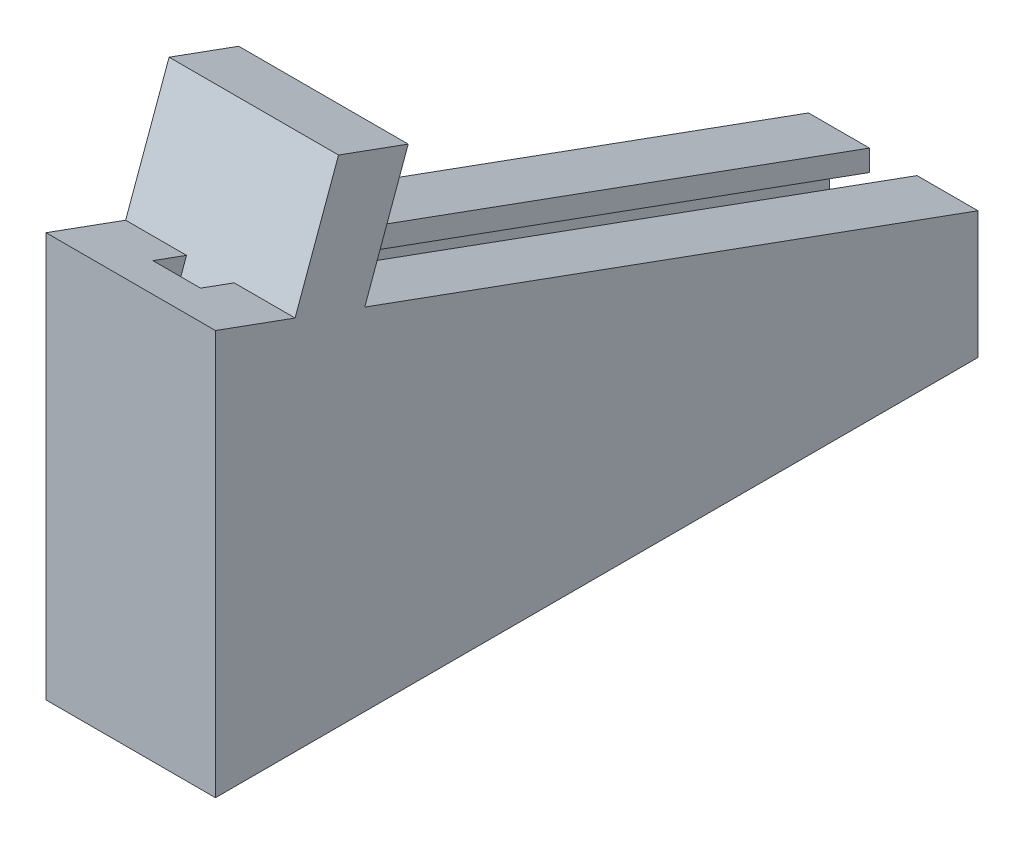
from build123d import *

# Parameters (mm, degrees)
BOSS_EXTRUDE1_DEPTH = 8
BOSS_EXTRUDE2_DEPTH = 8


with BuildPart() as part:
    # Sketch2 → Boss-Extrude1 (new body)
    with BuildSketch(Plane(origin=(0, 0, 0), x_dir=(0, 0, -1), z_dir=(1, 0, 0))):
        Polygon((-10.928495294, -9.782945939), (25.071504706, -9.782945939), (25.071504706, -3.782945939), (-10.928495294, 9.319982495), align=None)
    extrude(amount=-BOSS_EXTRUDE1_DEPTH)

    # Cut-Sweep3: sweep along a path in Sketch5
    with BuildLine(Plane.ZY.offset(8)) as cut_sweep3_path:
        Line((-25.071504706, -6.975479256), (8.757429642, 5.337245904))
    # Sketch3 → Cut-Sweep3 (sweep, cut)
    with BuildSketch(Plane(origin=(0, 0, -25.071504706), x_dir=(-1, 0, 0), z_dir=(0, 0, -1))):
        Polygon((2.875, -3.782945939), (2.875, -4.782945939), (1, -4.782945939), (1, -6.782945939), (7, -6.782945939), (7, -4.782945939), (5.125, -4.782945939), (5.125, -3.782945939), align=None)
    sweep(path=cut_sweep3_path.line, mode=Mode.SUBTRACT)

    # Sketch6 → Boss-Extrude2 (add)
    with BuildSketch(Plane.ZY.offset(8)):
        Polygon((4.906861068, 3.935753558), (8.195785241, 5.132824059), (5.117603951, 13.590057646), (1.828679778, 12.392987145), align=None)
    extrude(amount=-BOSS_EXTRUDE2_DEPTH)


solid = part.part
